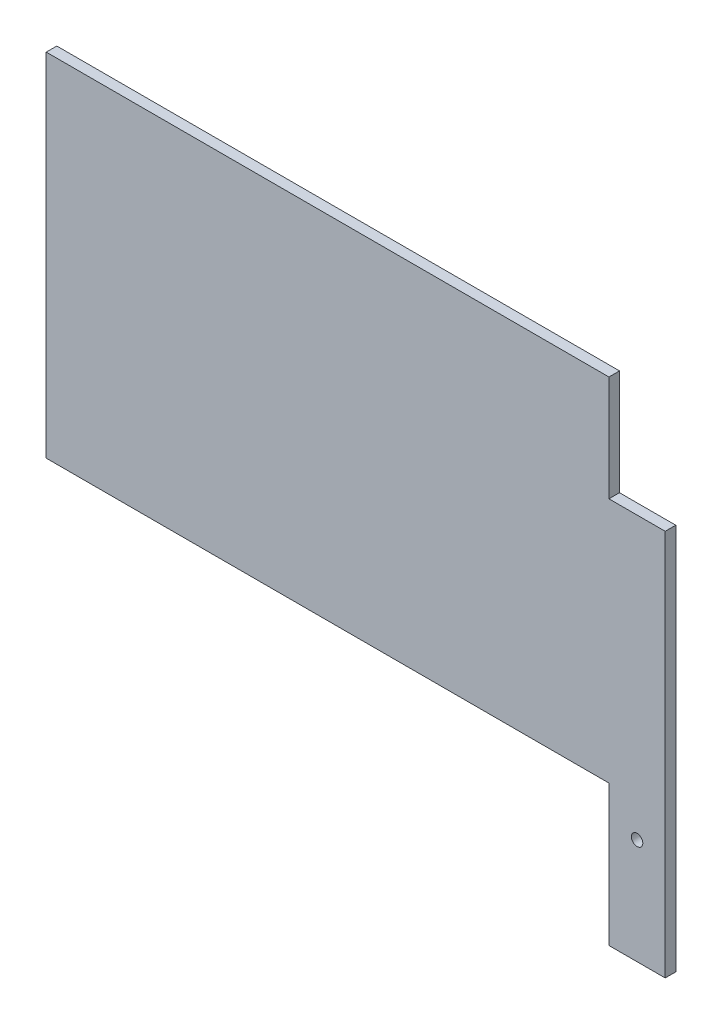
from build123d import *

# Parameters (mm, degrees)
SKETCH1_W           = 80
SKETCH1_H           = 50
BOSS_EXTRUDE1_DEPTH = 1.5
SKETCH6_W           = 1.5
SKETCH6_H           = 20
BOSS_EXTRUDE4_DEPTH = 8
SKETCH8_W           = 8
SKETCH8_H           = 1.5
BOSS_EXTRUDE5_DEPTH = 35
SKETCH9_R           = 0.815
CUT_EXTRUDE2_DEPTH  = 80.368828479


with BuildPart() as part:
    # Sketch1 → Boss-Extrude1 (new body)
    with BuildSketch(Plane.XY):
        with Locations((13.251028807, -5.452674897)):
            Rectangle(SKETCH1_W, SKETCH1_H)
    extrude(amount=BOSS_EXTRUDE1_DEPTH)

    # Sketch6 → Boss-Extrude4 (add)
    with BuildSketch(Plane(origin=(53.251028807, 0, 0), x_dir=(0, 0, -1), z_dir=(1, 0, 0))):
        with Locations((-0.75, -5.452674897)):
            Rectangle(SKETCH6_W, SKETCH6_H)
    extrude(amount=BOSS_EXTRUDE4_DEPTH)

    # Sketch8 → Boss-Extrude5 (add)
    with BuildSketch(Plane.XZ.offset(15.452674897)):
        with Locations((57.251028807, 0.75)):
            Rectangle(SKETCH8_W, SKETCH8_H)
    extrude(amount=BOSS_EXTRUDE5_DEPTH)

    # Sketch9 → Cut-Extrude2 (cut, through all)
    with BuildSketch(Plane(origin=(0, 0, 0), x_dir=(-1, 0, 0), z_dir=(0, 0, -1))):
        with Locations(Location((-57.251028807, -35.452674897, 0), (0, 0, 90))):
            Circle(SKETCH9_R)
    extrude(amount=-CUT_EXTRUDE2_DEPTH, mode=Mode.SUBTRACT)


solid = part.part
